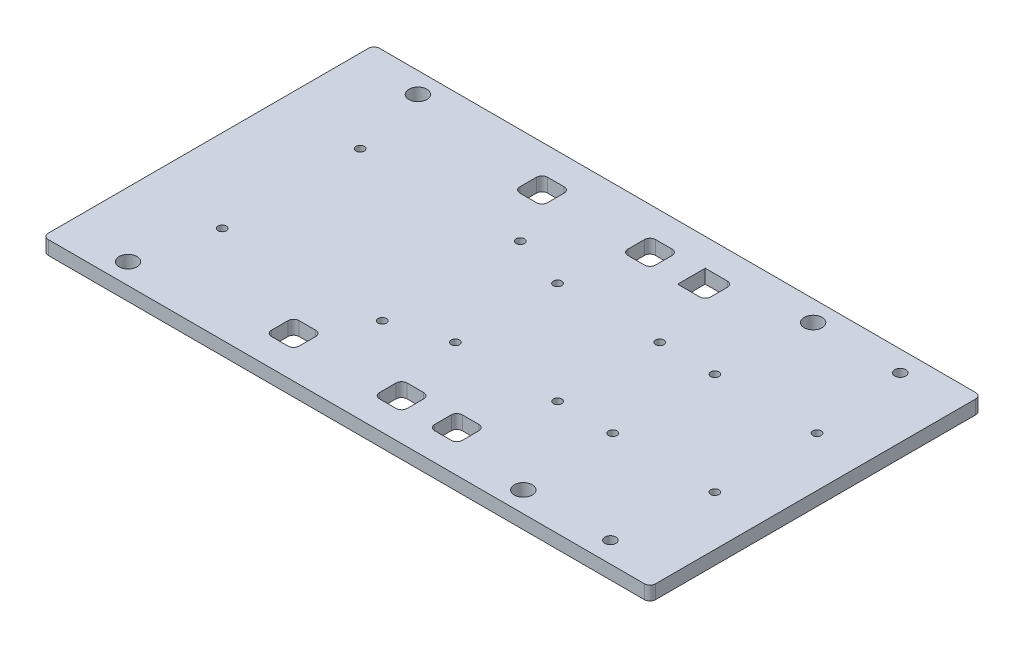
from build123d import *

# Parameters (mm, degrees)
SKETCH1_W           = 220
SKETCH1_H           = 120
SKETCH1_R           = 1.5
BOSS_EXTRUDE1_DEPTH = 5
SKETCH2_R           = 3.25
CUT_EXTRUDE1_DEPTH  = 5
SKETCH3_W           = 10
SKETCH3_H           = 10
CUT_EXTRUDE2_DEPTH  = 82.783407155
SKETCH4_W           = 10
SKETCH4_H           = 10
CUT_EXTRUDE3_DEPTH  = 5
FILLET1_R           = 2
SKETCH5_R           = 2
CUT_EXTRUDE4_DEPTH  = 5


with BuildPart() as part:
    # Sketch1 → Boss-Extrude1 (new body)
    with BuildSketch(Plane(origin=(0, 0, 0), x_dir=(1, 0, 0), z_dir=(0, 1, 0))):
        Rectangle(SKETCH1_W, SKETCH1_H)
        with Locations(Location((-22, 25, 0), (0, 0, 270))):
            Circle(SKETCH1_R, mode=Mode.SUBTRACT)
        with Locations(Location((-80, 25, 0), (0, 0, 90))):
            Circle(SKETCH1_R, mode=Mode.SUBTRACT)
        with Locations(Location((-22, -25, 0), (0, 0, 90))):
            Circle(SKETCH1_R, mode=Mode.SUBTRACT)
        with Locations(Location((-80, -25, 0), (0, 0, 270))):
            Circle(SKETCH1_R, mode=Mode.SUBTRACT)
        with Locations(Location((-2, 18.5, 0), (0, 0, 270))):
            Circle(SKETCH1_R, mode=Mode.SUBTRACT)
        with Locations(Location((35, 18.5, 0), (0, 0, 90))):
            Circle(SKETCH1_R, mode=Mode.SUBTRACT)
        with Locations(Location((35, -18.5, 0), (0, 0, 270))):
            Circle(SKETCH1_R, mode=Mode.SUBTRACT)
        with Locations(Location((-2, -18.5, 0), (0, 0, 90))):
            Circle(SKETCH1_R, mode=Mode.SUBTRACT)
        with Locations(Location((55, -18.5, 0), (0, 0, 90))):
            Circle(SKETCH1_R, mode=Mode.SUBTRACT)
        with Locations(Location((92, -18.5, 0), (0, 0, 270))):
            Circle(SKETCH1_R, mode=Mode.SUBTRACT)
        with Locations(Location((55, 18.5, 0), (0, 0, 270))):
            Circle(SKETCH1_R, mode=Mode.SUBTRACT)
        with Locations(Location((92, 18.5, 0), (0, 0, 90))):
            Circle(SKETCH1_R, mode=Mode.SUBTRACT)
    extrude(amount=BOSS_EXTRUDE1_DEPTH)

    # Sketch2 → Cut-Extrude1 (cut)
    with BuildSketch(Plane.XZ):
        with Locations(Location((56.593545043, -52.5, 0), (0, 0, 270))):
            Circle(SKETCH2_R)
        with Locations(Location((-86.593545043, -52.5, 0), (0, 0, 270))):
            Circle(SKETCH2_R)
        with Locations(Location((-86.593545043, 52.5, 0), (0, 0, 270))):
            Circle(SKETCH2_R)
        with Locations(Location((56.593545043, 52.5, 0), (0, 0, 270))):
            Circle(SKETCH2_R)
    extrude(amount=-CUT_EXTRUDE1_DEPTH, mode=Mode.SUBTRACT)

    # Sketch3 → Cut-Extrude2 (cut)
    with BuildSketch(Plane(origin=(0, 5, 0), x_dir=(1, 0, 0), z_dir=(0, 1, 0))):
        with Locations((5, -45)):
            Rectangle(SKETCH3_W, SKETCH3_H)
        with Locations((25, -45)):
            Rectangle(SKETCH3_W, SKETCH3_H)
        with Locations((25, 45)):
            Rectangle(SKETCH3_W, SKETCH3_H)
        with Locations((5, 45)):
            Rectangle(SKETCH3_W, SKETCH3_H)
    extrude(amount=-CUT_EXTRUDE2_DEPTH, mode=Mode.SUBTRACT)

    # Sketch4 → Cut-Extrude3 (cut)
    with BuildSketch(Plane(origin=(0, 5, 0), x_dir=(1, 0, 0), z_dir=(0, 1, 0))):
        with Locations((-34.127158997, -45)):
            Rectangle(SKETCH4_W, SKETCH4_H)
        with Locations((-34.127158997, 45)):
            Rectangle(SKETCH4_W, SKETCH4_H)
    extrude(amount=-CUT_EXTRUDE3_DEPTH, mode=Mode.SUBTRACT)

    # Fillet1
    fillet1_edges = [part.edges().sort_by_distance(p)[0] for p in [
        (0, 2.5, -50),
        (10, 2.5, -50),
        (10, 2.5, -40),
        (0, 2.5, -40),
        (30, 2.5, -50),
        (30, 2.5, -40),
        (30, 2.5, 40),
        (30, 2.5, 50),
        (20, 2.5, 50),
        (20, 2.5, 40),
        (0, 2.5, 50),
        (0, 2.5, 40),
        (10, 2.5, 40),
        (10, 2.5, 50),
        (-29.127158997, 2.5, 40),
        (-29.127158997, 2.5, 50),
        (-39.127158997, 2.5, 50),
        (-39.127158997, 2.5, 40),
        (-39.127158997, 2.5, -50),
        (-29.127158997, 2.5, -50),
        (-29.127158997, 2.5, -40),
        (-39.127158997, 2.5, -40),
        (-110, 2.5, -60),
        (110, 2.5, -60),
        (110, 2.5, 60),
        (-110, 2.5, 60),
    ]]
    fillet(fillet1_edges, radius=FILLET1_R)

    # Sketch5 → Cut-Extrude4 (cut)
    with BuildSketch(Plane(origin=(0, 5, 0), x_dir=(1, 0, 0), z_dir=(0, 1, 0))):
        with Locations(Location((88.15035354, -52.5, 0), (0, 0, 270))):
            Circle(SKETCH5_R)
        with Locations(Location((88.15035354, 52.5, 0), (0, 0, 270))):
            Circle(SKETCH5_R)
    extrude(amount=-CUT_EXTRUDE4_DEPTH, mode=Mode.SUBTRACT)


solid = part.part
